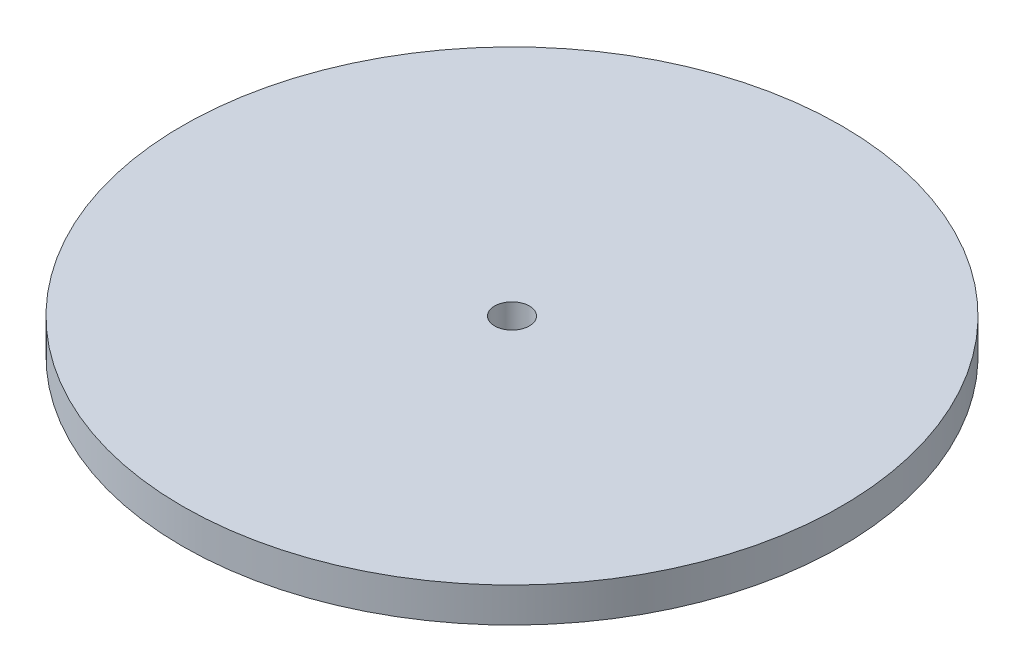
from build123d import *

# Parameters (mm, degrees)
SKETCH1_R           = 19
BOSS_EXTRUDE1_DEPTH = 2
SKETCH2_R           = 1
CUT_EXTRUDE1_DEPTH  = 2


with BuildPart() as part:
    # Sketch1 → Boss-Extrude1 (new body)
    with BuildSketch(Plane(origin=(0, 0, 0), x_dir=(1, 0, 0), z_dir=(0, 1, 0))):
        with Locations(Location((0, 0, 0), (0, 0, 270))):
            Circle(SKETCH1_R)
    extrude(amount=BOSS_EXTRUDE1_DEPTH)

    # Sketch2 → Cut-Extrude1 (cut)
    with BuildSketch(Plane(origin=(0, 2, 0), x_dir=(1, 0, 0), z_dir=(0, 1, 0))):
        with Locations(Location((0, 0, 0), (0, 0, 270))):
            Circle(SKETCH2_R)
    extrude(amount=-CUT_EXTRUDE1_DEPTH, mode=Mode.SUBTRACT)


solid = part.part
